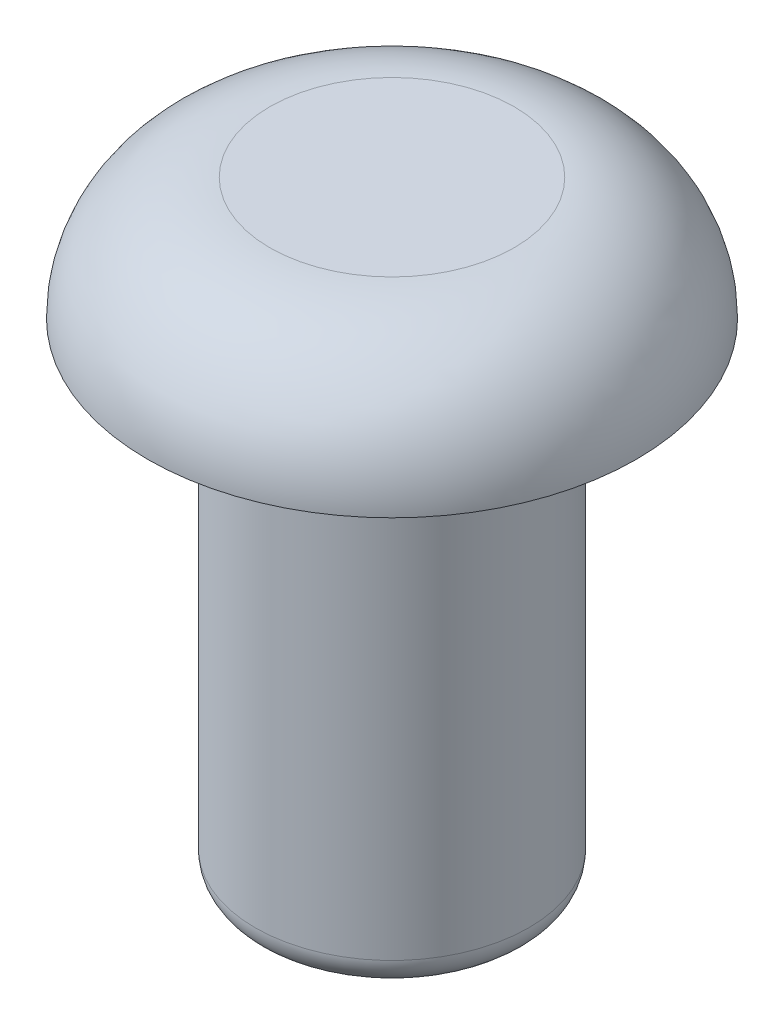
from build123d import *

# Parameters (mm, degrees)
FILLET1_R = 0.381


with BuildPart() as part:
    # Sketch1 → Revolve1 (revolve)
    with BuildSketch(Plane(origin=(0, 0, 0), x_dir=(0, 0, -1), z_dir=(1, 0, 0))):
        with BuildLine():
            Line((0, 0), (1.778, 0))
            Line((1.778, 0), (1.778, 6.35))
            Line((1.778, 6.35), (3.175, 6.35))
            ThreePointArc((3.175, 6.35), (2.710032015, 7.472532015), (1.5875, 7.9375))
            Line((1.5875, 7.9375), (0, 7.9375))
            Line((0, 7.9375), (0, 0))
        make_face()
    revolve(axis=Axis((0, 0, 0), (0, 1, 0)))

    # Fillet1
    fillet1_edges = [part.edges().sort_by_distance(p)[0] for p in [
        (0, 0, 1.778),
    ]]
    fillet(fillet1_edges, radius=FILLET1_R)


solid = part.part
